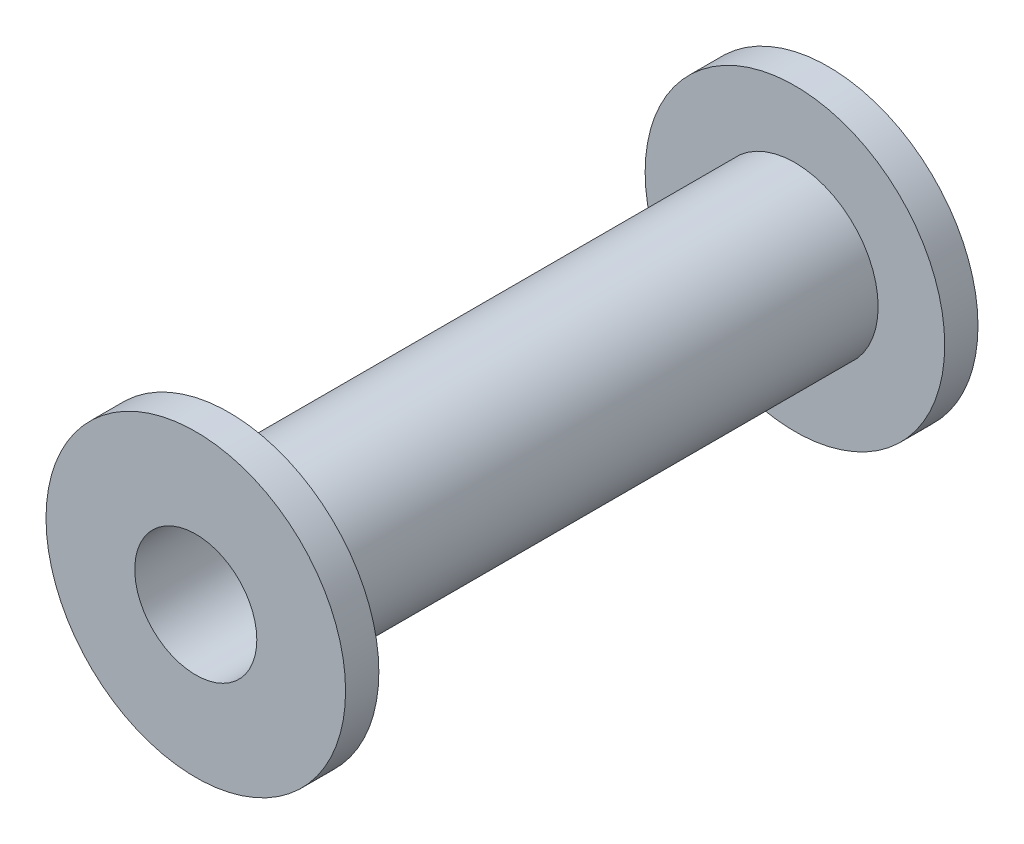
from build123d import *

# Parameters (mm, degrees)
ESBO_O1_R                = 13.5
ESBO_O1_R_2              = 5.5
RESSALTO_EXTRUS_O1_DEPTH = 3
ESBO_O2_R                = 7.5
ESBO_O2_R_2              = 5.5
RESSALTO_EXTRUS_O2_DEPTH = 51
ESBO_O3_R                = 13.5
ESBO_O3_R_2              = 5.5
RESSALTO_EXTRUS_O3_DEPTH = 3


with BuildPart() as part:
    # Esboço1 → Ressalto-extrusão1 (new body)
    with BuildSketch(Plane.XY):
        Circle(ESBO_O1_R)
        Circle(ESBO_O1_R_2, mode=Mode.SUBTRACT)
    extrude(amount=RESSALTO_EXTRUS_O1_DEPTH)

    # Esboço2 → Ressalto-extrusão2 (add)
    with BuildSketch(Plane.XY.offset(3)):
        Circle(ESBO_O2_R)
        Circle(ESBO_O2_R_2, mode=Mode.SUBTRACT)
    extrude(amount=RESSALTO_EXTRUS_O2_DEPTH)

    # Esboço3 → Ressalto-extrusão3 (add)
    with BuildSketch(Plane.XY.offset(54)):
        Circle(ESBO_O3_R)
        Circle(ESBO_O3_R_2, mode=Mode.SUBTRACT)
    extrude(amount=RESSALTO_EXTRUS_O3_DEPTH)


solid = part.part
